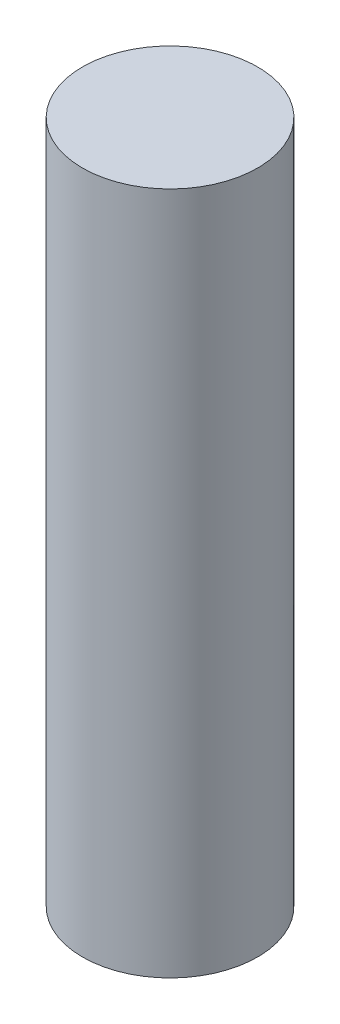
from build123d import *

# Parameters (mm, degrees)
CROQUIS1_R              = 100
SALIENTE_EXTRUIR1_DEPTH = 780


with BuildPart() as part:
    # Croquis1 → Saliente-Extruir1 (new body)
    with BuildSketch(Plane(origin=(0, 0, 0), x_dir=(1, 0, 0), z_dir=(0, 1, 0))):
        with Locations(Location((0, 0, 0), (0, 0, 270))):
            Circle(CROQUIS1_R)
    extrude(amount=SALIENTE_EXTRUIR1_DEPTH)


solid = part.part
